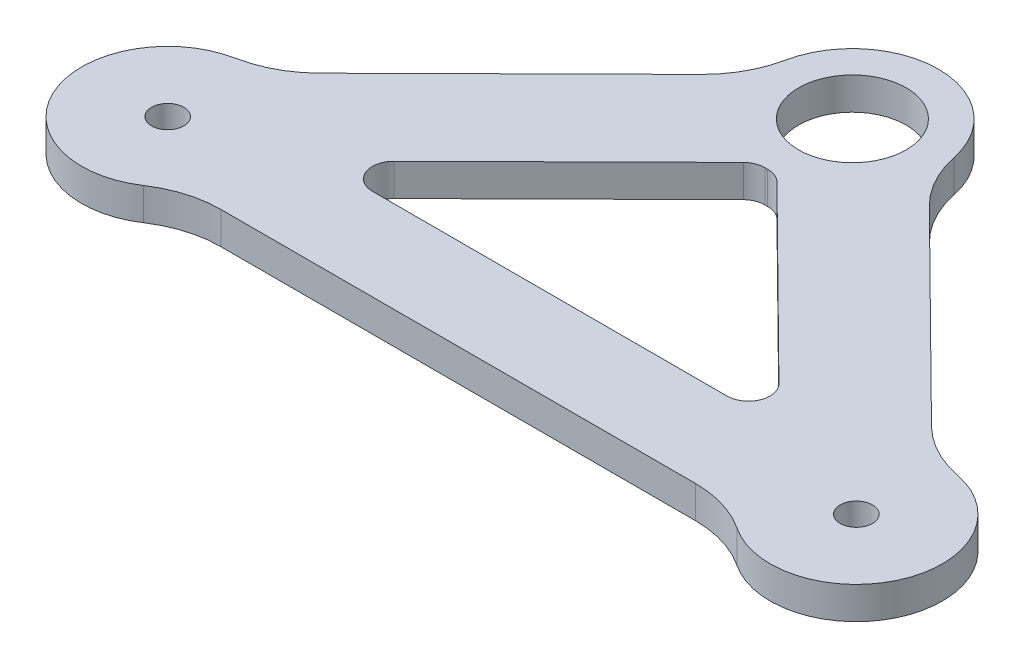
from build123d import *

# Parameters (mm, degrees)
SKETCH2_R           = 1.5
SKETCH2_R_2         = 5
BOSS_EXTRUDE1_DEPTH = 3
FILLET1_R           = 10
FILLET2_R           = 2


with BuildPart() as part:
    # Sketch2 → Boss-Extrude1 (new body)
    with BuildSketch(Plane(origin=(0, 0, 0), x_dir=(1, 0, 0), z_dir=(0, 1, 0))):
        with BuildLine():
            Line((-25.755002002, -7.091520556), (25.755002002, -7.091520556))
            ThreePointArc((25.755002002, -7.091520556), (39.399896119, -5.131510265), (31.07348397, 5.854646321))
            Line((31.07348397, 5.854646321), (7.956268299, 28.711722383))
            ThreePointArc((7.956268299, 28.711722383), (8.3294e-05, 37.547063483), (-7.956285692, 28.711888061))
            Line((-7.956285692, 28.711888061), (-31.074510761, 5.854765977))
            ThreePointArc((-31.074510761, 5.854765977), (-39.399699694, -5.131988356), (-25.755002002, -7.091520556))
        make_face()
        with Locations(Location((-32, -2.091520556, 0), (0, 0, 270))):
            Circle(SKETCH2_R, mode=Mode.SUBTRACT)
        with Locations(Location((32, -2.091520556, 0), (0, 0, 270))):
            Circle(SKETCH2_R, mode=Mode.SUBTRACT)
        with BuildLine():
            Line((0.92651603, 21.600896605), (21.348745942, 1.408479444))
            Line((21.348745942, 1.408479444), (-21.34844873, 1.408479444))
            Line((-21.34844873, 1.408479444), (-0.925489239, 21.60077695))
            ThreePointArc((-0.925489239, 21.60077695), (0.00051687, 21.5470635), (0.92651603, 21.600896605))
        make_face(mode=Mode.SUBTRACT)
        Polygon((0, 22.515813483), (0, 22.516986487), (0.000593189, 22.516399973), align=None, mode=Mode.SUBTRACT)
        with Locations(Location((0, 29.547063483, 0), (0, 0, 270))):
            Circle(SKETCH2_R_2, mode=Mode.SUBTRACT)
    extrude(amount=BOSS_EXTRUDE1_DEPTH)

    # Fillet1
    fillet1_edges = [part.edges().sort_by_distance(p)[0] for p in [
        (-25.755002002, 1.5, 7.091520556),
        (-31.074510761, 1.5, -5.854765977),
        (-7.956285692, 1.5, -28.711888061),
        (7.956268299, 1.5, -28.711722383),
        (31.07348397, 1.5, -5.854646321),
        (25.755002002, 1.5, 7.091520556),
    ]]
    fillet(fillet1_edges, radius=FILLET1_R)

    # Fillet2
    fillet2_edges = [part.edges().sort_by_distance(p)[0] for p in [
        (0.92651603, 1.5, -21.600896605),
        (-0.925489239, 1.5, -21.60077695),
        (-21.34844873, 1.5, -1.408479444),
        (21.348745942, 1.5, -1.408479444),
    ]]
    fillet(fillet2_edges, radius=FILLET2_R)


solid = part.part
